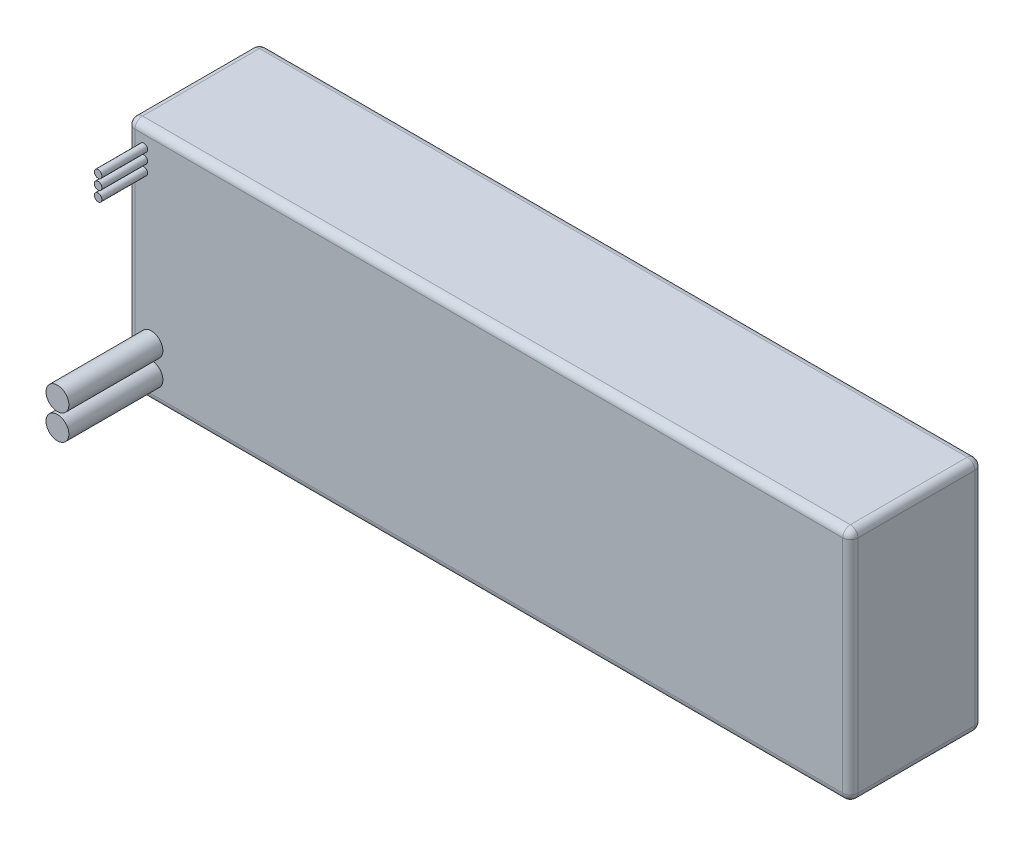
from build123d import *

# Parameters (mm, degrees)
BOSS_EXTRUDE1_DEPTH      = 13
BOSS_EXTRUDE1_DEPTH_BACK = 13
SKETCH1_W                = 142.3
SKETCH1_H                = 46.5
FILLET1_R                = 1.5
SKETCH2_R                = 2.25
BOSS_EXTRUDE2_DEPTH      = 18.5
SKETCH3_R                = 0.75
BOSS_EXTRUDE3_DEPTH      = 9


with BuildPart() as part:
    # Sketch1 → Boss-Extrude1 (new, two sides: drawn at the far end of the back side and taken through both)
    with BuildSketch(Plane.XY.offset(-BOSS_EXTRUDE1_DEPTH_BACK)):
        Rectangle(SKETCH1_W, SKETCH1_H)
    extrude(amount=BOSS_EXTRUDE1_DEPTH + BOSS_EXTRUDE1_DEPTH_BACK)

    # Fillet1
    fillet1_edges = [part.edges().sort_by_distance(p)[0] for p in [
        (-71.15, 0, -13),
        (0, -23.25, -13),
        (-71.15, -23.25, 0),
        (71.15, 0, -13),
        (71.15, -23.25, 0),
        (0, 23.25, -13),
        (71.15, 23.25, 0),
        (-71.15, 23.25, 0),
        (0, 23.25, 13),
        (71.15, 0, 13),
        (0, -23.25, 13),
        (-71.15, 0, 13),
    ]]
    fillet(fillet1_edges, radius=FILLET1_R)

    # Sketch2 → Boss-Extrude2 (add)
    with BuildSketch(Plane.XY.offset(13)):
        with Locations((-66.4, -18.25)):
            Circle(SKETCH2_R)
        with Locations((-66.4, -13.25)):
            Circle(SKETCH2_R)
    extrude(amount=BOSS_EXTRUDE2_DEPTH)

    # Sketch3 → Boss-Extrude3 (add)
    with BuildSketch(Plane.XY.offset(13)):
        with Locations((-67.9, 19.5)):
            Circle(SKETCH3_R)
        with Locations((-67.9, 17.5)):
            Circle(SKETCH3_R)
        with Locations((-67.9, 15.5)):
            Circle(SKETCH3_R)
    extrude(amount=BOSS_EXTRUDE3_DEPTH)


solid = part.part
